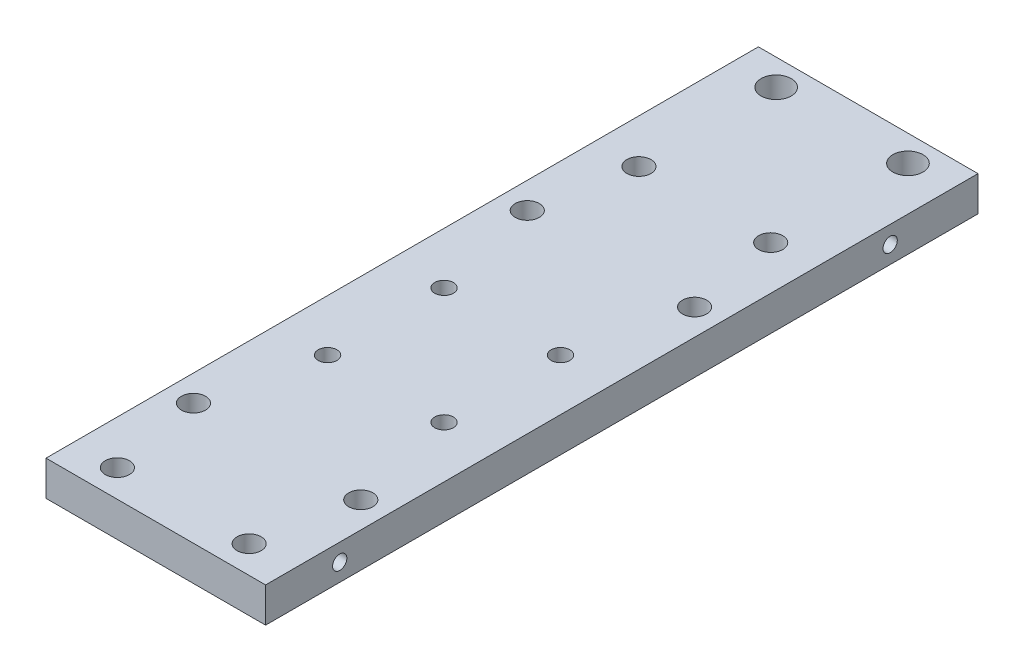
from build123d import *

# Parameters (mm, degrees)
SKETCH1_W               = 40
SKETCH1_H               = 160
BOSS_EXTRUDE1_DEPTH     = 3.175
M4_5_THROUGH_DEPTH      = 6.35
M4_5_THROUGH_DEPTH_BACK = 3.175
SKETCH3_R               = 2.75
SKETCH3_R_2             = 2.2
SKETCH4_R               = 1.3
M3_DRILL_DEPTH          = 8
SKETCH5_R               = 2.2
M4_THROUGH_DEPTH        = 6.35
M4_DRILL_DEPTH          = 3.175
M4_DRILL_DEPTH_BACK     = 10
SKETCH6_R               = 1.7
SKETCH7_W               = 40
SKETCH7_H               = 30.2375
CUT_EXTRUDE2_DEPTH      = 6.35
SKETCH8_R               = 1.3
CUT_EXTRUDE3_DEPTH      = 8


with BuildPart() as part:
    # Sketch1 → Boss-Extrude1 (new, symmetric)
    with BuildSketch(Plane(origin=(0, 0, 0), x_dir=(1, 0, 0), z_dir=(0, 1, 0))):
        Rectangle(SKETCH1_W, SKETCH1_H)
    extrude(amount=BOSS_EXTRUDE1_DEPTH, both=True)

    # Sketch3 → M4/5_through (cut, two sides: drawn at the far end of the back side and taken through both)
    with BuildSketch(Plane(origin=(0, 0, 0), x_dir=(1, 0, 0), z_dir=(0, 1, 0)).offset(-M4_5_THROUGH_DEPTH_BACK)):
        with Locations(Location((12, 75.2375, 0), (0, 0, 270))):
            Circle(SKETCH3_R)
        with Locations(Location((12, 50.2375, 0), (0, 0, 270))):
            Circle(SKETCH3_R_2)
        with Locations(Location((-12, 50.2375, 0), (0, 0, 270))):
            Circle(SKETCH3_R_2)
        with Locations(Location((-12, 75.2375, 0), (0, 0, 270))):
            Circle(SKETCH3_R)
        with Locations(Location((-12, -44.7625, 0), (0, 0, 270))):
            Circle(SKETCH3_R_2)
        with Locations(Location((12, -44.7625, 0), (0, 0, 270))):
            Circle(SKETCH3_R_2)
    extrude(amount=M4_5_THROUGH_DEPTH + M4_5_THROUGH_DEPTH_BACK, mode=Mode.SUBTRACT)

    # Sketch4 → M3_DRILL (cut)
    with BuildSketch(Plane(origin=(0, 0, -80), x_dir=(-1, 0, 0), z_dir=(0, 0, -1))):
        Circle(SKETCH4_R)
    extrude(amount=-M3_DRILL_DEPTH, mode=Mode.SUBTRACT)

    # Sketch5 → M4_through (cut)
    with BuildSketch(Plane(origin=(0, 3.175, 0), x_dir=(1, 0, 0), z_dir=(0, 1, 0))):
        with Locations(Location((-15.2375, -27.6625, 0), (0, 0, 270))):
            Circle(SKETCH5_R)
        with Locations(Location((15.2375, -27.6625, 0), (0, 0, 270))):
            Circle(SKETCH5_R)
        with Locations(Location((15.2375, 33.1375, 0), (0, 0, 270))):
            Circle(SKETCH5_R)
        with Locations(Location((-15.2375, 33.1375, 0), (0, 0, 270))):
            Circle(SKETCH5_R)
    extrude(amount=-M4_THROUGH_DEPTH, mode=Mode.SUBTRACT)

    # Sketch6 → M4_Drill (cut, two sides: drawn at the far end of the back side and taken through both)
    with BuildSketch(Plane(origin=(0, 0, 0), x_dir=(1, 0, 0), z_dir=(0, 1, 0)).offset(-M4_DRILL_DEPTH_BACK)):
        with Locations(Location((-10.606601718, 13.344101718, 0), (0, 0, 270))):
            Circle(SKETCH6_R)
        with Locations(Location((10.606601718, 13.344101718, 0), (0, 0, 270))):
            Circle(SKETCH6_R)
        with Locations(Location((10.606601718, -7.869101718, 0), (0, 0, 270))):
            Circle(SKETCH6_R)
        with Locations(Location((-10.606601718, -7.869101718, 0), (0, 0, 270))):
            Circle(SKETCH6_R)
    extrude(amount=M4_DRILL_DEPTH + M4_DRILL_DEPTH_BACK, mode=Mode.SUBTRACT)

    # Sketch7 → Cut-Extrude2 (cut)
    with BuildSketch(Plane(origin=(0, 3.175, 0), x_dir=(1, 0, 0), z_dir=(0, 1, 0))):
        with Locations((0, -64.88125)):
            Rectangle(SKETCH7_W, SKETCH7_H)
    extrude(amount=-CUT_EXTRUDE2_DEPTH, mode=Mode.SUBTRACT)

    # Sketch8 → Cut-Extrude3 (cut)
    with BuildSketch(Plane.ZY.offset(20)):
        with Locations((36.2625, 0)):
            Circle(SKETCH8_R)
        with Locations((-64, 0)):
            Circle(SKETCH8_R)
    cut_extrude3 = extrude(amount=-CUT_EXTRUDE3_DEPTH, mode=Mode.SUBTRACT)

    # Mirror1: Cut-Extrude3 across plane
    add(cut_extrude3.mirror(Plane(origin=(0, 0, 0), x_dir=(0, 0, 1), z_dir=(1, 0, 0))), mode=Mode.SUBTRACT)


solid = part.part
